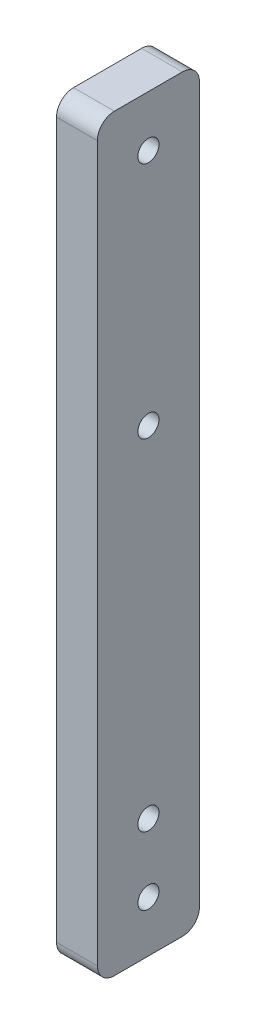
from build123d import *

# Parameters (mm, degrees)
SKETCH1_W           = 30
SKETCH1_H           = 220
SKETCH1_R           = 3.1
BOSS_EXTRUDE1_DEPTH = 12
FILLET1_R           = 5


with BuildPart() as part:
    # Sketch1 → Boss-Extrude1 (new body)
    with BuildSketch(Plane(origin=(0, 0, 0), x_dir=(0, 0, -1), z_dir=(1, 0, 0))):
        with Locations((0, 95)):
            Rectangle(SKETCH1_W, SKETCH1_H)
        Circle(SKETCH1_R, mode=Mode.SUBTRACT)
        with Locations((0, 20)):
            Circle(SKETCH1_R, mode=Mode.SUBTRACT)
        with Locations((0, 120)):
            Circle(SKETCH1_R, mode=Mode.SUBTRACT)
        with Locations((0, 190)):
            Circle(SKETCH1_R, mode=Mode.SUBTRACT)
    extrude(amount=BOSS_EXTRUDE1_DEPTH)

    # Fillet1
    fillet1_edges = [part.edges().sort_by_distance(p)[0] for p in [
        (6, 205, 15),
        (6, 205, -15),
        (6, -15, -15),
        (6, -15, 15),
    ]]
    fillet(fillet1_edges, radius=FILLET1_R)


solid = part.part
